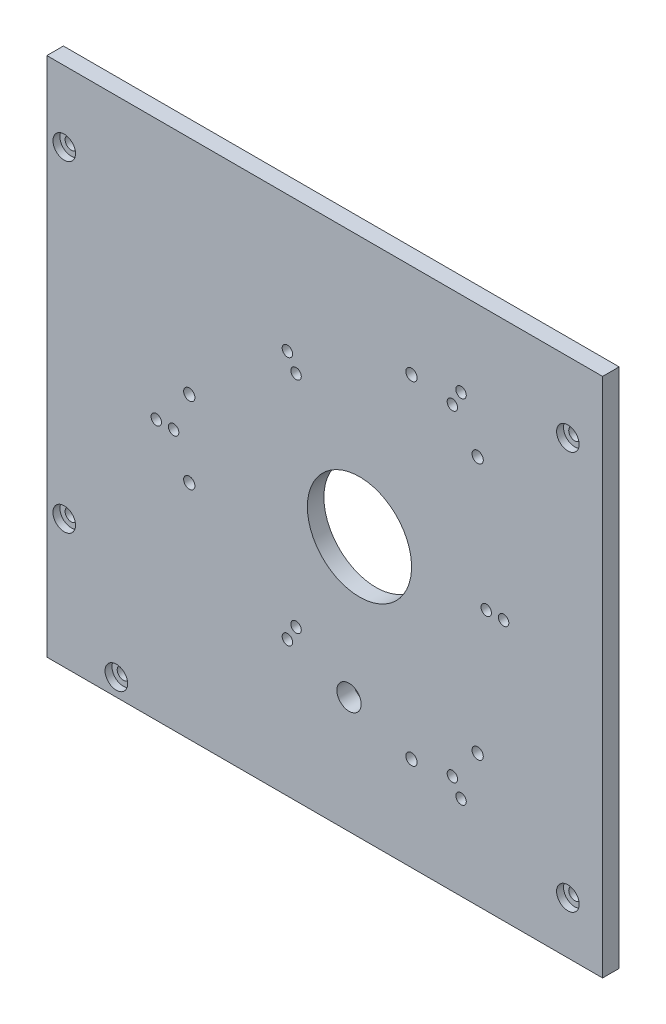
from build123d import *

# Parameters (mm, degrees)
SKETCH1_W                                        = 160
SKETCH1_H                                        = 150
BOSS_EXTRUDE1_DEPTH                              = 4.76
F_7_0_7_DIAMETER_HOLE1_D                         = 7
CBORE_FOR_M3_HEX_HEAD_MACHINE_SCREW1_D           = 3.5
CBORE_FOR_M3_HEX_HEAD_MACHINE_SCREW1_CBORE_D     = 6.5
CBORE_FOR_M3_HEX_HEAD_MACHINE_SCREW1_CBORE_DEPTH = 2
F_3_0_3_DIAMETER_HOLE1_D                         = 3
M27_CLEARANCE_HOLE1_D                            = 30


with BuildPart() as part:
    # Sketch1 → Boss-Extrude1 (new body)
    with BuildSketch(Plane.XY.offset(4.76)):
        with Locations((-10, 0)):
            Rectangle(SKETCH1_W, SKETCH1_H)
    extrude(amount=-BOSS_EXTRUDE1_DEPTH)

    # Sketch2 → Cut-Revolve1 (revolve, cut)
    with BuildSketch(Plane(origin=(0, 36.935244785, 0), x_dir=(1, 0, 0), z_dir=(0, 1, 0))):
        Polygon((35.647279442, 0), (34.026279442, 0), (34.026279442, -4.76), (35.647279442, -4.76), (35.647279442, -2.76), align=None)
    revolve(axis=Axis((34.026279442, 36.935244785, 0), (0, 0, 1)), mode=Mode.SUBTRACT)

    # Sketch3 → Cut-Revolve2 (revolve, cut)
    with BuildSketch(Plane(origin=(0, 11, 0), x_dir=(1, 0, 0), z_dir=(0, 1, 0))):
        Polygon((-47.379, 0), (-49, 0), (-49, -4.76), (-47.379, -4.76), (-47.379, -2.76), align=None)
    revolve(axis=Axis((-49, 11, 0), (0, 0, 1)), mode=Mode.SUBTRACT)

    # Sketch4 → Cut-Revolve3 (revolve, cut)
    with BuildSketch(Plane(origin=(0, -36.935244785, 0), x_dir=(1, 0, 0), z_dir=(0, 1, 0))):
        Polygon((35.647279442, 0), (34.026279442, 0), (34.026279442, -4.76), (35.647279442, -4.76), (35.647279442, -2.76), align=None)
    revolve(axis=Axis((34.026279442, -36.935244785, 0), (0, 0, 1)), mode=Mode.SUBTRACT)

    # Sketch5 → Cut-Revolve4 (revolve, cut)
    with BuildSketch(Plane(origin=(0, -47.935244785, 0), x_dir=(1, 0, 0), z_dir=(0, 1, 0))):
        Polygon((16.594720558, 0), (14.973720558, 0), (14.973720558, -4.76), (16.594720558, -4.76), (16.594720558, -2.76), align=None)
    revolve(axis=Axis((14.973720558, -47.935244785, 0), (0, 0, 1)), mode=Mode.SUBTRACT)

    # Sketch6 → Cut-Revolve5 (revolve, cut)
    with BuildSketch(Plane(origin=(0, 47.935244785, 0), x_dir=(1, 0, 0), z_dir=(0, 1, 0))):
        Polygon((16.594720558, 0), (14.973720558, 0), (14.973720558, -4.76), (16.594720558, -4.76), (16.594720558, -2.76), align=None)
    revolve(axis=Axis((14.973720558, 47.935244785, 0), (0, 0, 1)), mode=Mode.SUBTRACT)

    # Sketch7 → Cut-Revolve6 (revolve, cut)
    with BuildSketch(Plane(origin=(0, -11, 0), x_dir=(1, 0, 0), z_dir=(0, 1, 0))):
        Polygon((-47.379, 0), (-49, 0), (-49, -4.76), (-47.379, -4.76), (-47.379, -2.76), align=None)
    revolve(axis=Axis((-49, -11, 0), (0, 0, 1)), mode=Mode.SUBTRACT)

    # Ø7.0 (7) Diameter Hole1 (through all)
    with Locations(Plane(origin=(0, 0, 0), x_dir=(-1, 0, 0), z_dir=(0, 0, -1))):
        with Locations((3, -41.5)):
            Hole(F_7_0_7_DIAMETER_HOLE1_D / 2)

    # CBORE for M3 Hex Head Machine Screw1 (through all)
    with Locations(Plane.XY.offset(4.76)):
        with Locations((-70, -70), (60, -60), (-84.999999999, 54.667182961), (60, 54.667182961), (-84.999999999, -38.000000001)):
            CounterBoreHole(CBORE_FOR_M3_HEX_HEAD_MACHINE_SCREW1_D / 2, CBORE_FOR_M3_HEX_HEAD_MACHINE_SCREW1_CBORE_D / 2, CBORE_FOR_M3_HEX_HEAD_MACHINE_SCREW1_CBORE_DEPTH)

    # Ø3.0 (3) Diameter Hole1 (through all)
    with Locations(Plane(origin=(0, 0, 0), x_dir=(-1, 0, 0), z_dir=(0, 0, -1))):
        with Locations((20.75, 35.940054257), (18.25, 31.609927238), (20.75, -35.940054257), (18.25, -31.609927238), (-41.5, 0), (-29.250000001, 50.662486121), (-26.750000001, 46.332359102), (-36.5, 0), (58.5, 1e-09), (53.5, 1e-09), (-26.749999999, -46.332359103), (-29.249999999, -50.662486122)):
            Hole(F_3_0_3_DIAMETER_HOLE1_D / 2)

    # M27 Clearance Hole1 (through all)
    with Locations(Plane(origin=(0, 0, 0), x_dir=(-1, 0, 0), z_dir=(0, 0, -1))):
        with Locations((0, 0)):
            Hole(M27_CLEARANCE_HOLE1_D / 2)


solid = part.part
